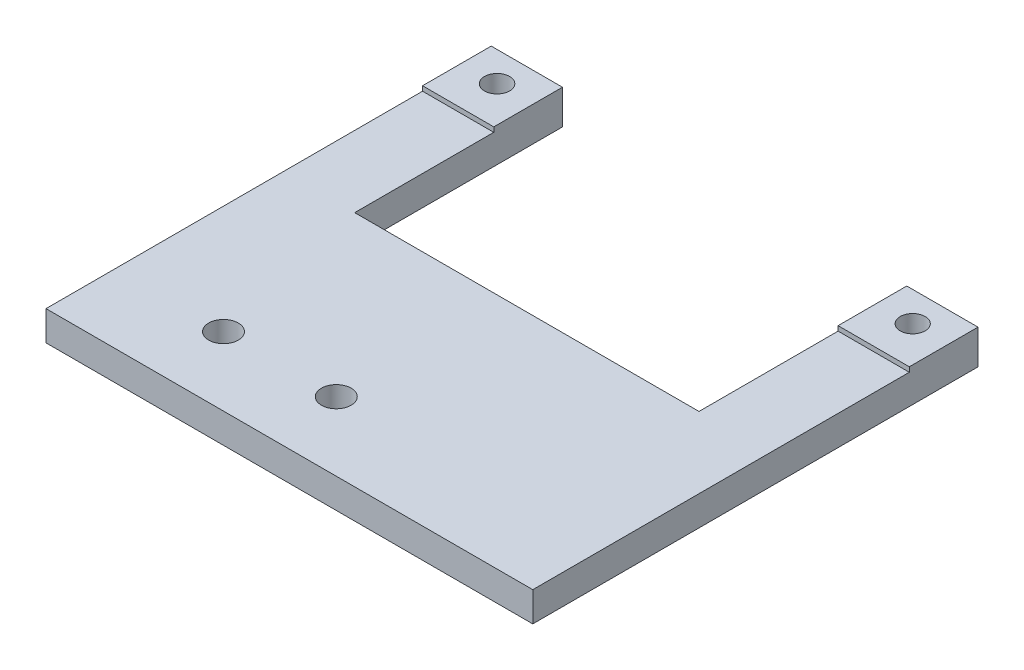
from build123d import *

# Parameters (mm, degrees)
SKETCH1_R           = 1.05
BOSS_EXTRUDE1_DEPTH = 2.5
CUT_EXTRUDE1_START  = -2.5
SKETCH2_R           = 1.25
CUT_EXTRUDE1_DEPTH  = 83.005276467
SKETCH3_W           = 6
SKETCH3_H           = 5.785041524
BOSS_EXTRUDE2_DEPTH = 0.4
SKETCH4_R           = 1.05
SKETCH4_R_2         = 1.059817418
CUT_EXTRUDE2_DEPTH  = 80.518859311


with BuildPart() as part:
    # Sketch1 → Boss-Extrude1 (new body)
    with BuildSketch(Plane(origin=(0, 0, 0), x_dir=(1, 0, 0), z_dir=(0, 1, 0))):
        Polygon((-37.781503794, -28.817561111), (-43.781503794, -28.817561111), (-43.781503794, -66.317561111), (-2.781503794, -66.317561111), (-2.781503794, -28.817561111), (-8.781503794, -28.817561111), (-8.781503794, -46.317561111), (-37.781503794, -46.317561111), align=None)
        with Locations(Location((-40.781503794, -31.317561111, 0), (0, 0, 270))):
            Circle(SKETCH1_R, mode=Mode.SUBTRACT)
        with Locations(Location((-5.781503794, -31.317561111, 0), (0, 0, 270))):
            Circle(SKETCH1_R, mode=Mode.SUBTRACT)
    extrude(amount=BOSS_EXTRUDE1_DEPTH)

    # Sketch2 → Cut-Extrude1 (cut, through all)
    with BuildSketch(Plane(origin=(0, 2.5, 0), x_dir=(1, 0, 0), z_dir=(0, 1, 0)).offset(CUT_EXTRUDE1_START)):
        with Locations(Location((-34.631503794, -60.517561111, 0), (0, 0, 270))):
            Circle(SKETCH2_R)
        with Locations(Location((-25.131503794, -60.517561111, 0), (0, 0, 270))):
            Circle(SKETCH2_R)
    extrude(amount=CUT_EXTRUDE1_DEPTH, mode=Mode.SUBTRACT)

    # Sketch3 → Boss-Extrude2 (add)
    with BuildSketch(Plane(origin=(0, 2.5, 0), x_dir=(1, 0, 0), z_dir=(0, 1, 0))):
        with Locations((-40.781503794, -31.710081873)):
            Rectangle(SKETCH3_W, SKETCH3_H)
        with Locations((-5.781503794, -31.710081873)):
            Rectangle(SKETCH3_W, SKETCH3_H)
    extrude(amount=BOSS_EXTRUDE2_DEPTH)

    # Sketch4 → Cut-Extrude2 (cut, through all)
    with BuildSketch(Plane.XZ):
        with Locations(Location((-5.781503794, 31.317561111, 0), (0, 0, 270))):
            Circle(SKETCH4_R)
        with Locations(Location((-40.791321212, 31.317561111, 0), (0, 0, 270))):
            Circle(SKETCH4_R_2)
    extrude(amount=-CUT_EXTRUDE2_DEPTH, mode=Mode.SUBTRACT)


solid = part.part
